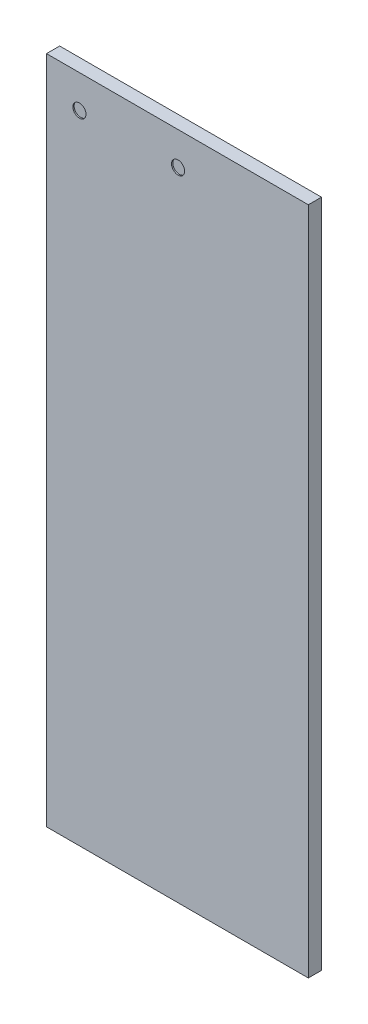
from build123d import *

# Parameters (mm, degrees)
SKETCH1_W           = 398
SKETCH1_H           = 1018
BOSS_EXTRUDE1_DEPTH = 20
SKETCH2_R           = 10
CUT_EXTRUDE1_DEPTH  = 2


with BuildPart() as part:
    # Sketch1 → Boss-Extrude1 (new body)
    with BuildSketch(Plane.XY):
        Rectangle(SKETCH1_W, SKETCH1_H)
    extrude(amount=BOSS_EXTRUDE1_DEPTH)

    # Sketch2 → Cut-Extrude1 (cut)
    with BuildSketch(Plane.XY.offset(20)):
        with Locations((-149, 459)):
            Circle(SKETCH2_R)
        with Locations((1, 459)):
            Circle(SKETCH2_R)
    extrude(amount=-CUT_EXTRUDE1_DEPTH, mode=Mode.SUBTRACT)


solid = part.part
